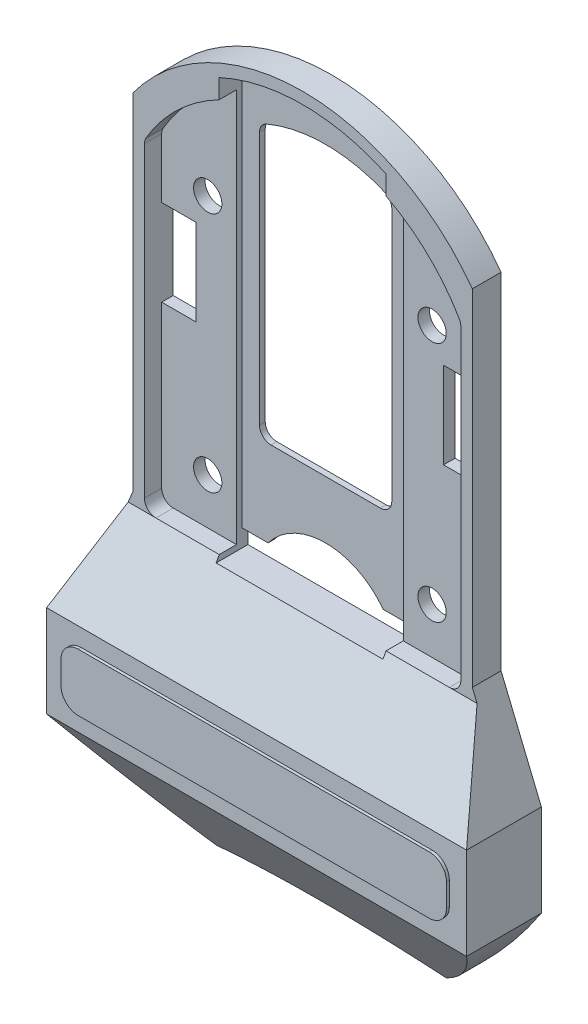
from build123d import *

# Parameters (mm, degrees)
BOSS_EXTRUDE1_DEPTH            = 1
BOSS_EXTRUDE2_DEPTH            = 2
BOSS_EXTRUDE3_DEPTH            = 5
BOSS_EXTRUDE4_DEPTH            = 13
CUT_EXTRUDE1_REACH             = 99.519
CUT_EXTRUDE1_DIRECTION_2_REACH = 99.519
BOSS_EXTRUDE5_DEPTH            = 0.5
F_10_0_1935_DIAMETER_HOLE1_D   = 4.9149


with BuildPart() as part:
    # Sketch1 → Boss-Extrude1 (new body)
    with BuildSketch(Plane.XY):
        with BuildLine():
            Line((-14.5, 27.975526805), (-14.5, -38.491666667))
            Line((-14.5, -38.491666667), (-10, -38.491666667))
            ThreePointArc((-10, -38.491666667), (0, -33.491666667), (10, -38.491666667))
            Line((10, -38.491666667), (14.5, -38.491666667))
            Line((14.5, -38.491666667), (14.5, 27.975526805))
            Line((14.5, 27.975526805), (14.5, 31.314135298))
            ThreePointArc((14.5, 31.314135298), (0, 34.508333333), (-14.5, 31.314135298))
            Line((-14.5, 31.314135298), (-14.5, 27.975526805))
        make_face()
        with BuildLine():
            Line((-11.5, -21.491666667), (-11.5, 22.592219961))
            ThreePointArc((-11.5, 22.592219961), (-11.165907115, 23.698905773), (-10.275246515, 24.435855728))
            ThreePointArc((-10.275246515, 24.435855728), (0, 26.508333333), (10.275246515, 24.435855728))
            ThreePointArc((10.275246515, 24.435855728), (11.165907115, 23.698905773), (11.5, 22.592219961))
            Line((11.5, 22.592219961), (11.5, -21.491666667))
            ThreePointArc((11.5, -21.491666667), (10.914213562, -22.905880229), (9.5, -23.491666667))
            Line((9.5, -23.491666667), (-9.5, -23.491666667))
            ThreePointArc((-9.5, -23.491666667), (-10.914213562, -22.905880229), (-11.5, -21.491666667))
        make_face(mode=Mode.SUBTRACT)
    extrude(amount=BOSS_EXTRUDE1_DEPTH)

    # Sketch1<3> → Boss-Extrude2 (add)
    with BuildSketch(Plane.XY):
        with BuildLine():
            ThreePointArc((-27.5, -38.491666667), (-26.914213562, -39.905880229), (-25.5, -40.491666667))
            Line((-25.5, -40.491666667), (-14.5, -40.491666667))
            Line((-14.5, -40.491666667), (-14.5, 27.975526805))
            ThreePointArc((-14.5, 27.975526805), (-21.72589695, 22.822477992), (-27.228227719, 15.858868663))
            ThreePointArc((-27.228227719, 15.858868663), (-27.430861911, 15.373593751), (-27.5, 14.85227592))
            Line((-27.5, 14.85227592), (-27.5, 4.508333333))
            Line((-27.5, 4.508333333), (-21.5, 4.508333333))
            Line((-21.5, 4.508333333), (-21.5, -10.491666667))
            Line((-21.5, -10.491666667), (-27.5, -10.491666667))
            Line((-27.5, -10.491666667), (-27.5, -38.491666667))
        make_face()
        with BuildLine():
            Line((14.5, -40.491666667), (25.5, -40.491666667))
            ThreePointArc((25.5, -40.491666667), (26.914213562, -39.905880229), (27.5, -38.491666667))
            Line((27.5, -38.491666667), (27.5, -10.491666667))
            Line((27.5, -10.491666667), (21.5, -10.491666667))
            Line((21.5, -10.491666667), (21.5, 4.508333333))
            Line((21.5, 4.508333333), (27.5, 4.508333333))
            Line((27.5, 4.508333333), (27.5, 14.85227592))
            ThreePointArc((27.5, 14.85227592), (27.430861911, 15.373593751), (27.228227719, 15.858868663))
            ThreePointArc((27.228227719, 15.858868663), (21.72589695, 22.822477992), (14.5, 27.975526805))
            Line((14.5, 27.975526805), (14.5, -40.491666667))
        make_face()
    extrude(amount=BOSS_EXTRUDE2_DEPTH)

    # Sketch1<5> → Boss-Extrude3 (add)
    with BuildSketch(Plane.XY):
        with BuildLine():
            ThreePointArc((29.5, 21.508333333), (0, 36.508333333), (-29.5, 21.508333333))
            Line((-29.5, 21.508333333), (-29.5, -38.491666667))
            Line((-29.5, -38.491666667), (-30.323529412, -40.491666667))
            Line((-30.323529412, -40.491666667), (-25.5, -40.491666667))
            ThreePointArc((-25.5, -40.491666667), (-26.914213562, -39.905880229), (-27.5, -38.491666667))
            Line((-27.5, -38.491666667), (-27.5, -10.491666667))
            Line((-27.5, -10.491666667), (-27.5, 4.508333333))
            Line((-27.5, 4.508333333), (-27.5, 14.85227592))
            ThreePointArc((-27.5, 14.85227592), (-27.430861911, 15.373593751), (-27.228227719, 15.858868663))
            ThreePointArc((-27.228227719, 15.858868663), (-21.72589695, 22.822477992), (-14.5, 27.975526805))
            Line((-14.5, 27.975526805), (-14.5, 31.314135298))
            ThreePointArc((-14.5, 31.314135298), (0, 34.508333333), (14.5, 31.314135298))
            Line((14.5, 31.314135298), (14.5, 27.975526805))
            ThreePointArc((14.5, 27.975526805), (21.72589695, 22.822477992), (27.228227719, 15.858868663))
            ThreePointArc((27.228227719, 15.858868663), (27.430861911, 15.373593751), (27.5, 14.85227592))
            Line((27.5, 14.85227592), (27.5, 4.508333333))
            Line((27.5, 4.508333333), (27.5, -10.491666667))
            Line((27.5, -10.491666667), (27.5, -38.491666667))
            ThreePointArc((27.5, -38.491666667), (26.914213562, -39.905880229), (25.5, -40.491666667))
            Line((25.5, -40.491666667), (30.323529412, -40.491666667))
            Line((30.323529412, -40.491666667), (29.5, -38.491666667))
            Line((29.5, -38.491666667), (29.5, 21.508333333))
        make_face()
    extrude(amount=BOSS_EXTRUDE3_DEPTH)

    # Sketch1<6> → Boss-Extrude4 (add)
    with BuildSketch(Plane.XY):
        with BuildLine():
            Line((-25.5, -40.491666667), (-30.323529412, -40.491666667))
            Line((-30.323529412, -40.491666667), (-36.5, -55.491666667))
            Line((-36.5, -55.491666667), (-36.5, -71.491666667))
            ThreePointArc((-36.5, -71.491666667), (-28.968061706, -81.149889898), (-20, -89.491666667))
            ThreePointArc((-20, -89.491666667), (0, -86.951333591), (20, -89.491666667))
            ThreePointArc((20, -89.491666667), (28.968061706, -81.149889898), (36.5, -71.491666667))
            Line((36.5, -71.491666667), (36.5, -55.491666667))
            Line((36.5, -55.491666667), (30.323529412, -40.491666667))
            Line((30.323529412, -40.491666667), (25.5, -40.491666667))
            Line((25.5, -40.491666667), (14.5, -40.491666667))
            Line((14.5, -40.491666667), (14.5, -41.491666667))
            Line((14.5, -41.491666667), (-14.5, -41.491666667))
            Line((-14.5, -41.491666667), (-14.5, -40.491666667))
            Line((-14.5, -40.491666667), (-25.5, -40.491666667))
        make_face()
    extrude(amount=BOSS_EXTRUDE4_DEPTH)

    # Sketch2 → Cut-Extrude1 (cut, up to next)
    with BuildSketch(Plane(origin=(0, 0, 0), x_dir=(0, 0, -1), z_dir=(1, 0, 0)), mode=Mode.PRIVATE) as cut_extrude1_sk1:
        Polygon((-5, -40.491666667), (-13, -55.491666667), (-13, -40.491666667), align=None)
    cut_extrude1_tool1 = extrude(cut_extrude1_sk1.sketch, amount=-CUT_EXTRUDE1_REACH, mode=Mode.PRIVATE) & part.part
    # Sketch2 → Cut-Extrude1 (cut, up to next)
    with BuildSketch(Plane(origin=(0, 0, 0), x_dir=(0, 0, -1), z_dir=(1, 0, 0)), mode=Mode.PRIVATE) as cut_extrude1_sk2:
        Polygon((-13, -71.491666667), (0, -89.491666667), (-13, -89.491666667), align=None)
    cut_extrude1_tool2 = extrude(cut_extrude1_sk2.sketch, amount=-CUT_EXTRUDE1_REACH, mode=Mode.PRIVATE) & part.part
    add(cut_extrude1_tool1.solids().sort_by_distance((0, -45.491667, 10.333333))[0], mode=Mode.SUBTRACT)
    add(cut_extrude1_tool2.solids().sort_by_distance((0, -83.491667, 8.666667))[0], mode=Mode.SUBTRACT)

    # Sketch2 → Cut-Extrude1 direction 2 (cut, up to next)
    with BuildSketch(Plane(origin=(0, 0, 0), x_dir=(0, 0, -1), z_dir=(1, 0, 0)), mode=Mode.PRIVATE) as cut_extrude1_direction_2_sk1:
        Polygon((-5, -40.491666667), (-13, -55.491666667), (-13, -40.491666667), align=None)
    cut_extrude1_direction_2_tool1 = extrude(cut_extrude1_direction_2_sk1.sketch, amount=CUT_EXTRUDE1_DIRECTION_2_REACH, mode=Mode.PRIVATE) & part.part
    # Sketch2 → Cut-Extrude1 direction 2 (cut, up to next)
    with BuildSketch(Plane(origin=(0, 0, 0), x_dir=(0, 0, -1), z_dir=(1, 0, 0)), mode=Mode.PRIVATE) as cut_extrude1_direction_2_sk2:
        Polygon((-13, -71.491666667), (0, -89.491666667), (-13, -89.491666667), align=None)
    cut_extrude1_direction_2_tool2 = extrude(cut_extrude1_direction_2_sk2.sketch, amount=CUT_EXTRUDE1_DIRECTION_2_REACH, mode=Mode.PRIVATE) & part.part
    add(cut_extrude1_direction_2_tool1.solids().sort_by_distance((0, -45.491667, 10.333333))[0], mode=Mode.SUBTRACT)
    add(cut_extrude1_direction_2_tool2.solids().sort_by_distance((0, -83.491667, 8.666667))[0], mode=Mode.SUBTRACT)

    # Sketch3 → Boss-Extrude5 (add)
    with BuildSketch(Plane.XY.offset(13)):
        with BuildLine():
            Line((-33.5, -61.491666667), (-33.5, -65.491666667))
            ThreePointArc((-33.5, -65.491666667), (-32.621320344, -67.61298701), (-30.5, -68.491666667))
            Line((-30.5, -68.491666667), (30.5, -68.491666667))
            ThreePointArc((30.5, -68.491666667), (32.621320344, -67.61298701), (33.5, -65.491666667))
            Line((33.5, -65.491666667), (33.5, -61.491666667))
            ThreePointArc((33.5, -61.491666667), (32.621320344, -59.370346323), (30.5, -58.491666667))
            Line((30.5, -58.491666667), (-30.5, -58.491666667))
            ThreePointArc((-30.5, -58.491666667), (-32.621320344, -59.370346323), (-33.5, -61.491666667))
        make_face()
    extrude(amount=BOSS_EXTRUDE5_DEPTH)

    # #10 (0.1935) Diameter Hole1 (through all)
    with Locations(Plane.XY.offset(2)):
        with Locations((19.5, -32.491666667), (-19.5, -32.491666667), (-19.5, 9.508333333), (19.5, 9.508333333)):
            Hole(F_10_0_1935_DIAMETER_HOLE1_D / 2)


solid = part.part
